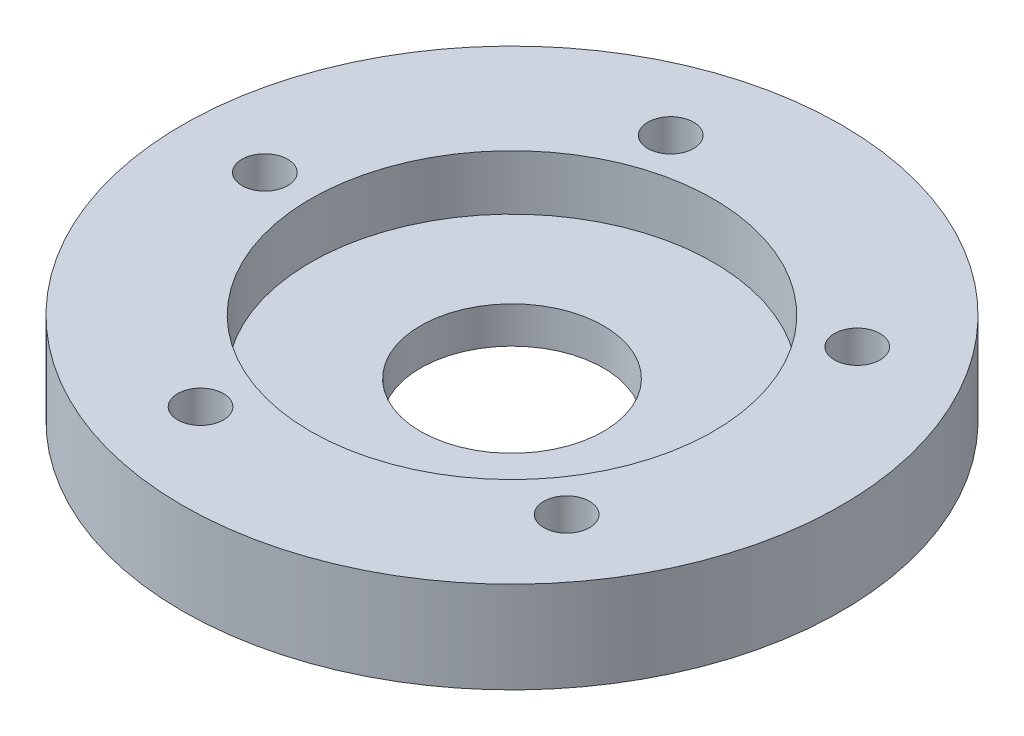
from build123d import *

# Parameters (mm, degrees)
BOSS_EXTRUDE1_DEPTH      = 2
BOSS_EXTRUDE1_DEPTH_BACK = 3
SKETCH1_R                = 16
SKETCH1_R_2              = 1.75
SKETCH1_R_3              = 1.25
SKETCH2_R                = 4.95
SKETCH2_R_2              = 2.95
BOSS_EXTRUDE3_DEPTH      = 3
SKETCH5_R                = 3.5
CUT_EXTRUDE2_DEPTH       = 4
SKETCH6_R                = 18
SKETCH6_R_2              = 16
BOSS_EXTRUDE4_DEPTH      = 5
CUT_EXTRUDE3_DEPTH       = 10
CUT_EXTRUDE3_DEPTH_BACK  = 3
SKETCH7_R                = 11
SKETCH8_R                = 5
CUT_EXTRUDE4_DEPTH       = 3


with BuildPart() as part:
    # Sketch1 → Boss-Extrude1 (new, two sides: drawn at the far end of the back side and taken through both)
    with BuildSketch(Plane(origin=(0, 0, 0), x_dir=(1, 0, 0), z_dir=(0, 1, 0)).offset(-BOSS_EXTRUDE1_DEPTH_BACK)):
        with Locations(Location((0, 0, 0), (0, 0, 270))):
            Circle(SKETCH1_R)
        with Locations(Location((0, 0, 0), (0, 0, 270))):
            Circle(SKETCH1_R_2, mode=Mode.SUBTRACT)
        with Locations(Location((-13.5, 0, 0), (0, 0, 270))):
            Circle(SKETCH1_R_3, mode=Mode.SUBTRACT)
        with Locations(Location((-4.171729424, 12.83926297, 0), (0, 0, 270))):
            Circle(SKETCH1_R_3, mode=Mode.SUBTRACT)
        with Locations(Location((10.921729424, 7.935100906, 0), (0, 0, 270))):
            Circle(SKETCH1_R_3, mode=Mode.SUBTRACT)
        with Locations(Location((10.921729424, -7.935100906, 0), (0, 0, 270))):
            Circle(SKETCH1_R_3, mode=Mode.SUBTRACT)
        with Locations(Location((-4.171729424, -12.83926297, 0), (0, 0, 270))):
            Circle(SKETCH1_R_3, mode=Mode.SUBTRACT)
    extrude(amount=BOSS_EXTRUDE1_DEPTH + BOSS_EXTRUDE1_DEPTH_BACK)

    # Sketch2 → Boss-Extrude3 (add)
    with BuildSketch(Plane(origin=(0, 2, 0), x_dir=(1, 0, 0), z_dir=(0, 1, 0))):
        with Locations(Location((0, 0, 0), (0, 0, 270))):
            Circle(SKETCH2_R)
        with Locations(Location((0, 0, 0), (0, 0, 270))):
            Circle(SKETCH2_R_2, mode=Mode.SUBTRACT)
    extrude(amount=BOSS_EXTRUDE3_DEPTH)

    # Sketch5 → Cut-Extrude2 (cut)
    with BuildSketch(Plane.XZ.offset(3)):
        with Locations(Location((0, 0, 0), (0, 0, 270))):
            Circle(SKETCH5_R)
    extrude(amount=-CUT_EXTRUDE2_DEPTH, mode=Mode.SUBTRACT)

    # Sketch6 → Boss-Extrude4 (add)
    with BuildSketch(Plane(origin=(0, 2, 0), x_dir=(1, 0, 0), z_dir=(0, 1, 0))):
        with Locations(Location((0, 0, 0), (0, 0, 270))):
            Circle(SKETCH6_R)
        Circle(SKETCH6_R_2, mode=Mode.SUBTRACT)
    extrude(amount=-BOSS_EXTRUDE4_DEPTH)

    # Sketch7 → Cut-Extrude3 (cut, two sides: drawn at the far end of the back side and taken through both)
    with BuildSketch(Plane(origin=(0, 2, 0), x_dir=(1, 0, 0), z_dir=(0, 1, 0)).offset(-CUT_EXTRUDE3_DEPTH_BACK)):
        with Locations(Location((0, 0, 0), (0, 0, 270))):
            Circle(SKETCH7_R)
    extrude(amount=CUT_EXTRUDE3_DEPTH + CUT_EXTRUDE3_DEPTH_BACK, mode=Mode.SUBTRACT)

    # Sketch8 → Cut-Extrude4 (cut)
    with BuildSketch(Plane(origin=(0, -1, 0), x_dir=(1, 0, 0), z_dir=(0, 1, 0))):
        with Locations(Location((0, 0, 0), (0, 0, 270))):
            Circle(SKETCH8_R)
    extrude(amount=-CUT_EXTRUDE4_DEPTH, mode=Mode.SUBTRACT)


solid = part.part
